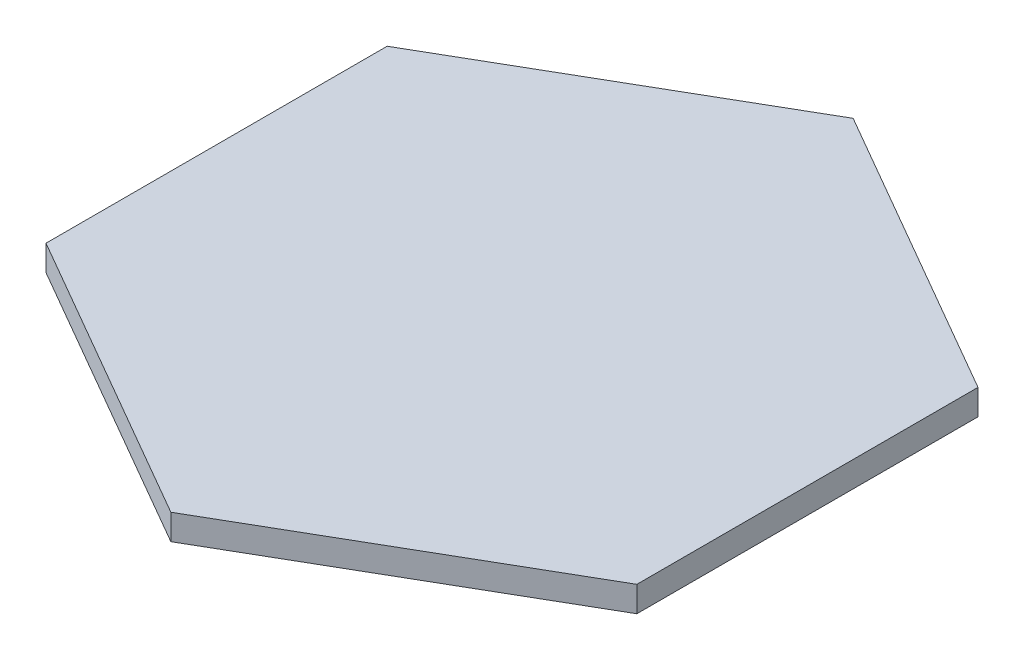
from build123d import *

# Parameters (mm, degrees)
BOSS_EXTRU_1_DEPTH = 38


with BuildPart() as part:
    # Esquisse1 → Boss.-Extru.1 (new body)
    with BuildSketch(Plane(origin=(0, 0, 0), x_dir=(1, 0, 0), z_dir=(0, 1, 0))):
        Polygon((440, -254.034118443), (440, 254.034118443), (0, 508.068236887), (-440, 254.034118443), (-440, -254.034118443), (0, -508.068236887), align=None)
    extrude(amount=BOSS_EXTRU_1_DEPTH)


solid = part.part
